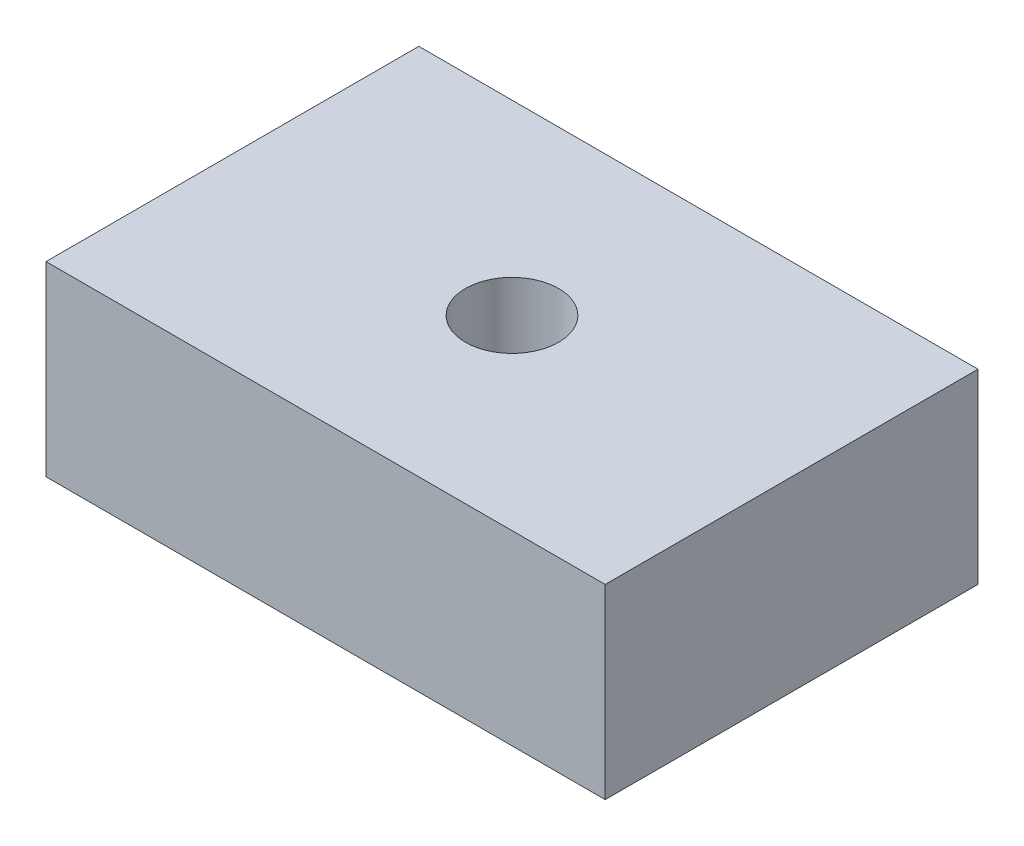
from build123d import *

# Parameters (mm, degrees)
SKETCH1_W           = 30
SKETCH1_H           = 20
SKETCH1_R           = 2.5
BOSS_EXTRUDE1_DEPTH = 10


with BuildPart() as part:
    # Sketch1 → Boss-Extrude1 (new body)
    with BuildSketch(Plane(origin=(0, 0, 0), x_dir=(1, 0, 0), z_dir=(0, 1, 0))):
        Rectangle(SKETCH1_W, SKETCH1_H)
        with Locations(Location((0, 0, 0), (0, 0, 270))):
            Circle(SKETCH1_R, mode=Mode.SUBTRACT)
    extrude(amount=BOSS_EXTRUDE1_DEPTH)


solid = part.part
